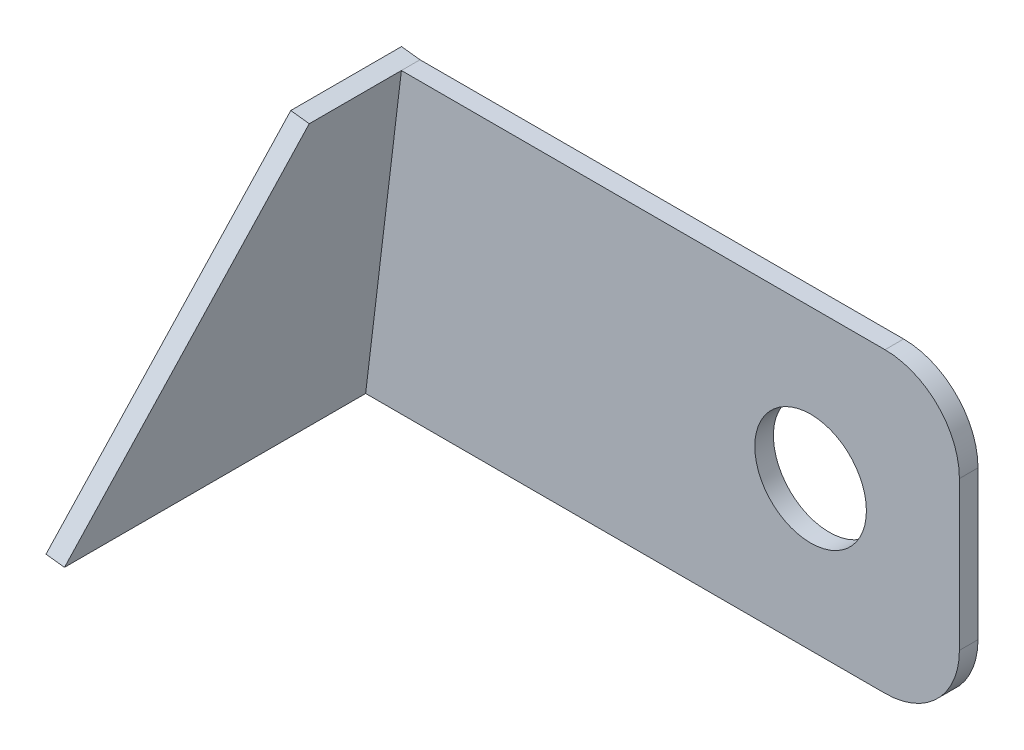
from build123d import *

# Parameters (mm, degrees)
BOSS_EXTRUDE1_DEPTH     = 1.5875
CUT_EXTRUDE1_DEPTH      = 50.314813
CUT_EXTRUDE1_DEPTH_BACK = 50.314813
SKETCH3_R               = 4.7625
BOSS_EXTRUDE2_DEPTH     = 1.5875
FILLET1_R               = 6.35


with BuildPart() as part:
    # Sketch1 → Boss-Extrude1 (new body)
    with BuildSketch(Plane.XY):
        Polygon((0, 12.7), (-3.051249826, -12.7), (0, -12.7), (47.625, -12.7), (47.625, 12.7), align=None)
    extrude(amount=BOSS_EXTRUDE1_DEPTH)

    # Sketch3 → Cut-Extrude1 (cut, two sides: drawn at the far end of the back side and taken through both)
    with BuildSketch(Plane.XY.offset(1.5875).offset(-CUT_EXTRUDE1_DEPTH_BACK)):
        with Locations((34.925, 0)):
            Circle(SKETCH3_R)
    extrude(amount=CUT_EXTRUDE1_DEPTH + CUT_EXTRUDE1_DEPTH_BACK, mode=Mode.SUBTRACT)

    # Sketch2 → Boss-Extrude2 (add)
    with BuildSketch(Plane(origin=(-1.503922228, 0.180663088, 0), x_dir=(0, 0, 1), z_dir=(-0.9928618030717177, 0.11927044898539502, 0))):
        Polygon((0, 12.609344899), (0, -12.973268836), (27.295308913, -12.973268836), (9.453791039, 12.609344899), align=None)
    extrude(amount=BOSS_EXTRUDE2_DEPTH)

    # Fillet1
    fillet1_edges = [part.edges().sort_by_distance(p)[0] for p in [
        (47.625, 12.7, 0.79375),
        (47.625, -12.7, 0.79375),
    ]]
    fillet(fillet1_edges, radius=FILLET1_R)


solid = part.part
